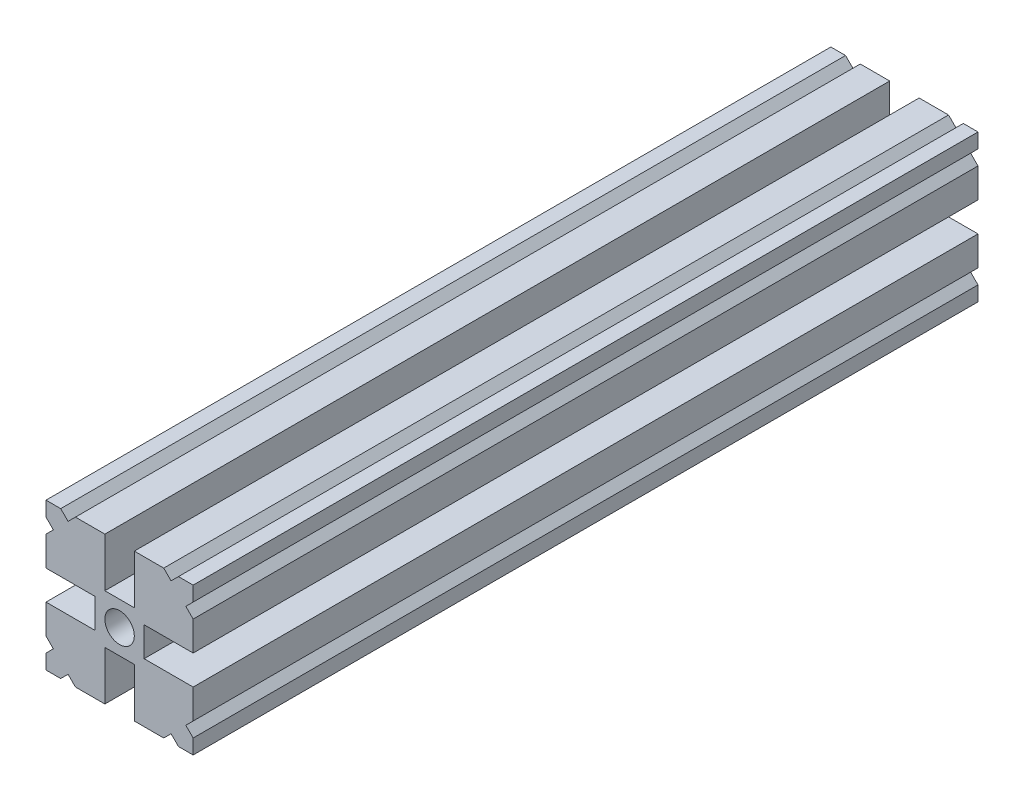
from build123d import *

# Parameters (mm, degrees)
SKETCH1_R           = 1.5
BOSS_EXTRUDE1_DEPTH = 80


with BuildPart() as part:
    # Sketch1 → Boss-Extrude1 (new body)
    with BuildSketch(Plane.XY):
        Polygon((-7.5, 7.5), (-6, 7.5), (-5.25, 6.75), (-4.5, 7.5), (-1.5, 7.5), (-1.5, 2.5), (1.5, 2.5), (1.5, 7.5), (4.5, 7.5), (5.25, 6.75), (6, 7.5), (7.5, 7.5), (7.5, 6), (6.75, 5.25), (7.5, 4.5), (7.5, 1.5), (2.5, 1.5), (2.5, -1.5), (7.5, -1.5), (7.5, -4.5), (6.75, -5.25), (7.5, -6), (7.5, -7.5), (6, -7.5), (5.25, -6.75), (4.5, -7.5), (1.5, -7.5), (1.5, -2.5), (-1.5, -2.5), (-1.5, -7.5), (-4.5, -7.5), (-5.25, -6.75), (-6, -7.5), (-7.5, -7.5), (-7.5, -6), (-6.75, -5.25), (-7.5, -4.5), (-7.5, -1.5), (-2.5, -1.5), (-2.5, 1.5), (-7.5, 1.5), (-7.5, 4.5), (-6.75, 5.25), (-7.5, 6), align=None)
        Circle(SKETCH1_R, mode=Mode.SUBTRACT)
    extrude(amount=BOSS_EXTRUDE1_DEPTH)


solid = part.part
